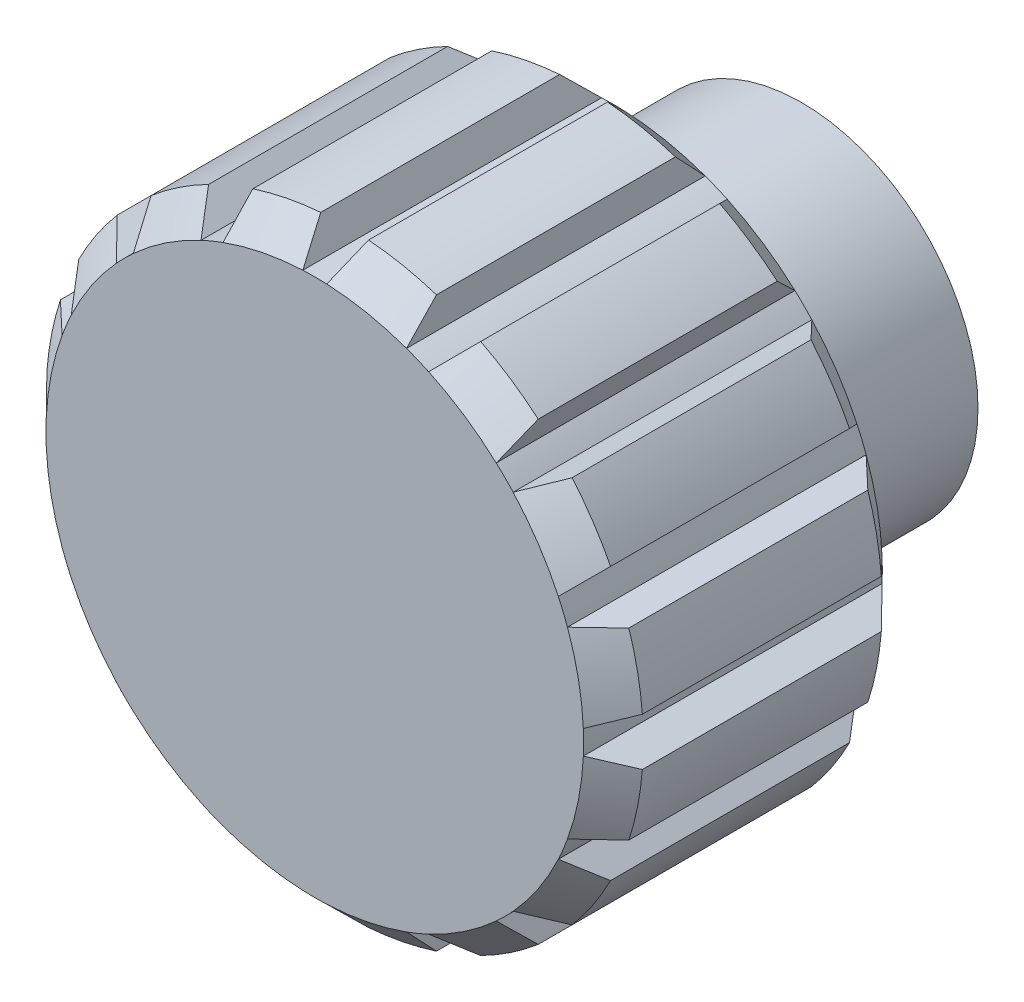
from build123d import *

# Parameters (mm, degrees)
SKETCH1_R           = 7.5
BOSS_EXTRUDE1_DEPTH = 8
SKETCH2_R           = 12.7
BOSS_EXTRUDE2_DEPTH = 12.7
CHAMFER1_SIZE       = 1.27
CUT_EXTRUDE2_DEPTH  = 12.7


with BuildPart() as part:
    # Sketch1 → Boss-Extrude1 (new body)
    with BuildSketch(Plane.XY):
        Circle(SKETCH1_R)
        with BuildLine():
            Line((-2.711977876, 1.651), (2.711977876, 1.651))
            ThreePointArc((2.711977876, 1.651), (0, -3.175), (-2.711977876, 1.651))
        make_face(mode=Mode.SUBTRACT)
    extrude(amount=BOSS_EXTRUDE1_DEPTH)

    # Sketch2 → Boss-Extrude2 (add)
    with BuildSketch(Plane.XY.offset(8)):
        Circle(SKETCH2_R)
    extrude(amount=BOSS_EXTRUDE2_DEPTH)

    # Chamfer1
    chamfer1_edges = [part.edges().sort_by_distance(p)[0] for p in [
        (-12.7, 0, 8),
        (-12.7, 0, 20.7),
    ]]
    chamfer(chamfer1_edges, length=CHAMFER1_SIZE)

    # Sketch3 → Cut-Extrude2 (cut)
    with BuildSketch(Plane.XY.offset(20.7)):
        with BuildLine():
            Line((-1.494578623, 13.823081897), (-0.508, 11.418705531))
            ThreePointArc((-0.508, 11.418705531), (0, 11.43), (0.508, 11.418705531))
            Line((0.508, 11.418705531), (1.494578623, 13.823081897))
            Line((1.494578623, 13.823081897), (-1.494578623, 13.823081897))
        make_face()
        with BuildLine():
            Line((3.909053826, 13.342812918), (6.670675026, 12.198911963))
            Line((6.670675026, 12.198911963), (4.839080228, 10.355105144))
            ThreePointArc((4.839080228, 10.355105144), (4.374071632, 10.559943057), (3.900418623, 10.743911511))
            Line((3.900418623, 10.743911511), (3.909053826, 13.342812918))
        make_face()
        with BuildLine():
            Line((8.717568266, 10.831221626), (10.831221626, 8.717568266))
            Line((10.831221626, 8.717568266), (8.433454358, 7.715033868))
            ThreePointArc((8.433454358, 7.715033868), (8.082230509, 8.082230509), (7.715033868, 8.433454358))
            Line((7.715033868, 8.433454358), (8.717568266, 10.831221626))
        make_face()
        with BuildLine():
            Line((12.198911963, 6.670675026), (13.342812918, 3.909053826))
            Line((13.342812918, 3.909053826), (10.743911511, 3.900418623))
            ThreePointArc((10.743911511, 3.900418623), (10.559943057, 4.374071632), (10.355105144, 4.839080228))
            Line((10.355105144, 4.839080228), (12.198911963, 6.670675026))
        make_face()
        with BuildLine():
            Line((13.823081897, 1.494578623), (13.823081897, -1.494578623))
            Line((13.823081897, -1.494578623), (11.418705531, -0.508))
            ThreePointArc((11.418705531, -0.508), (11.43, 0), (11.418705531, 0.508))
            Line((11.418705531, 0.508), (13.823081897, 1.494578623))
        make_face()
        with BuildLine():
            Line((13.342812918, -3.909053826), (12.198911963, -6.670675026))
            Line((12.198911963, -6.670675026), (10.355105144, -4.839080228))
            ThreePointArc((10.355105144, -4.839080228), (10.559943057, -4.374071632), (10.743911511, -3.900418623))
            Line((10.743911511, -3.900418623), (13.342812918, -3.909053826))
        make_face()
        with BuildLine():
            Line((10.831221626, -8.717568266), (8.717568266, -10.831221626))
            Line((8.717568266, -10.831221626), (7.715033868, -8.433454358))
            ThreePointArc((7.715033868, -8.433454358), (8.082230509, -8.082230509), (8.433454358, -7.715033868))
            Line((8.433454358, -7.715033868), (10.831221626, -8.717568266))
        make_face()
        with BuildLine():
            Line((6.670675026, -12.198911963), (3.909053826, -13.342812918))
            Line((3.909053826, -13.342812918), (3.900418623, -10.743911511))
            ThreePointArc((3.900418623, -10.743911511), (4.374071632, -10.559943057), (4.839080228, -10.355105144))
            Line((4.839080228, -10.355105144), (6.670675026, -12.198911963))
        make_face()
        with BuildLine():
            Line((1.494578623, -13.823081897), (-1.494578623, -13.823081897))
            Line((-1.494578623, -13.823081897), (-0.508, -11.418705531))
            ThreePointArc((-0.508, -11.418705531), (0, -11.43), (0.508, -11.418705531))
            Line((0.508, -11.418705531), (1.494578623, -13.823081897))
        make_face()
        with BuildLine():
            Line((-3.909053826, -13.342812918), (-6.670675026, -12.198911963))
            Line((-6.670675026, -12.198911963), (-4.839080228, -10.355105144))
            ThreePointArc((-4.839080228, -10.355105144), (-4.374071632, -10.559943057), (-3.900418623, -10.743911511))
            Line((-3.900418623, -10.743911511), (-3.909053826, -13.342812918))
        make_face()
        with BuildLine():
            Line((-8.717568266, -10.831221626), (-10.831221626, -8.717568266))
            Line((-10.831221626, -8.717568266), (-8.433454358, -7.715033868))
            ThreePointArc((-8.433454358, -7.715033868), (-8.082230509, -8.082230509), (-7.715033868, -8.433454358))
            Line((-7.715033868, -8.433454358), (-8.717568266, -10.831221626))
        make_face()
        with BuildLine():
            Line((-12.198911963, -6.670675026), (-13.342812918, -3.909053826))
            Line((-13.342812918, -3.909053826), (-10.743911511, -3.900418623))
            ThreePointArc((-10.743911511, -3.900418623), (-10.559943057, -4.374071632), (-10.355105144, -4.839080228))
            Line((-10.355105144, -4.839080228), (-12.198911963, -6.670675026))
        make_face()
        with BuildLine():
            Line((-13.823081897, -1.494578623), (-13.823081897, 1.494578623))
            Line((-13.823081897, 1.494578623), (-11.418705531, 0.508))
            ThreePointArc((-11.418705531, 0.508), (-11.43, 0), (-11.418705531, -0.508))
            Line((-11.418705531, -0.508), (-13.823081897, -1.494578623))
        make_face()
        with BuildLine():
            Line((-13.342812918, 3.909053826), (-12.198911963, 6.670675026))
            Line((-12.198911963, 6.670675026), (-10.355105144, 4.839080228))
            ThreePointArc((-10.355105144, 4.839080228), (-10.559943057, 4.374071632), (-10.743911511, 3.900418623))
            Line((-10.743911511, 3.900418623), (-13.342812918, 3.909053826))
        make_face()
        with BuildLine():
            Line((-10.831221626, 8.717568266), (-8.717568266, 10.831221626))
            Line((-8.717568266, 10.831221626), (-7.715033868, 8.433454358))
            ThreePointArc((-7.715033868, 8.433454358), (-8.082230509, 8.082230509), (-8.433454358, 7.715033868))
            Line((-8.433454358, 7.715033868), (-10.831221626, 8.717568266))
        make_face()
        with BuildLine():
            Line((-6.670675026, 12.198911963), (-3.909053826, 13.342812918))
            Line((-3.909053826, 13.342812918), (-3.900418623, 10.743911511))
            ThreePointArc((-3.900418623, 10.743911511), (-4.374071632, 10.559943057), (-4.839080228, 10.355105144))
            Line((-4.839080228, 10.355105144), (-6.670675026, 12.198911963))
        make_face()
    extrude(amount=-CUT_EXTRUDE2_DEPTH, mode=Mode.SUBTRACT)


solid = part.part
